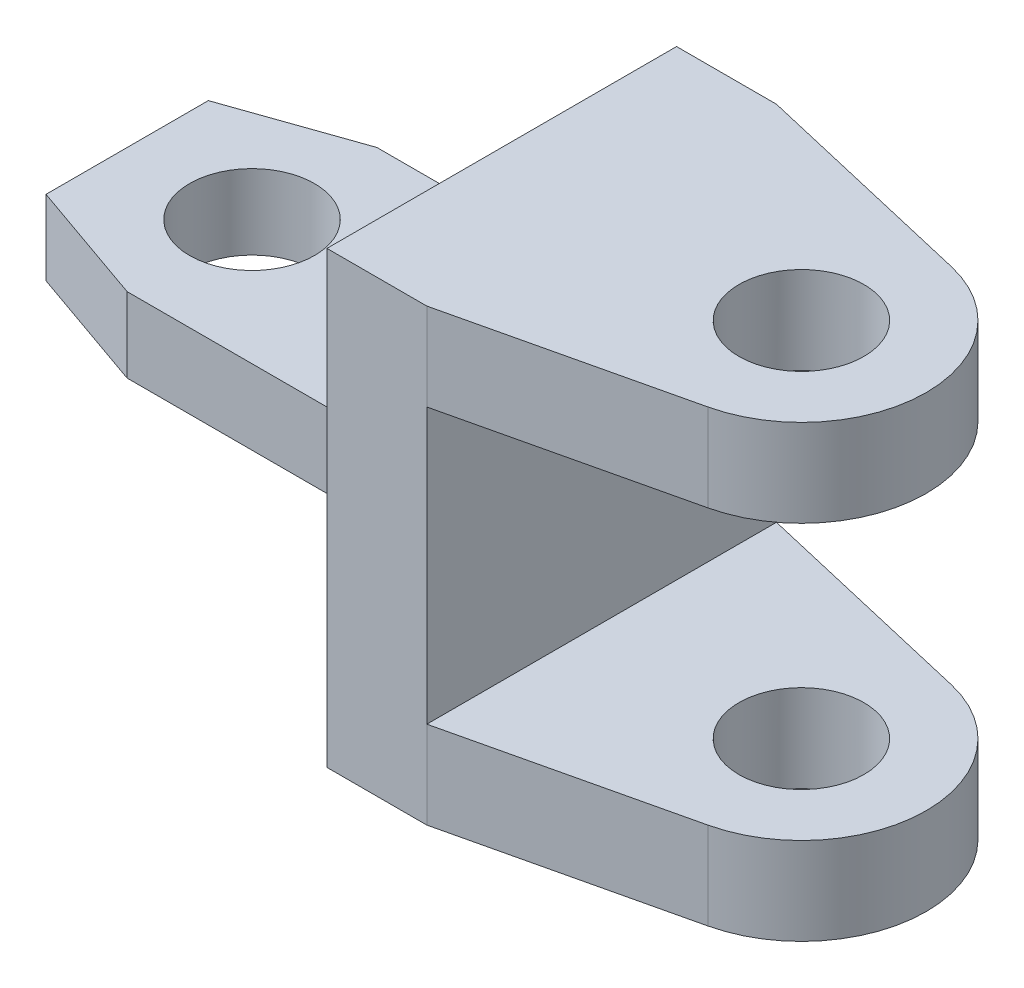
from build123d import *

# Parameters (mm, degrees)
BOSS_EXTRUDE3_DEPTH      = 18
BOSS_EXTRUDE3_DEPTH_BACK = 18
SKETCH1_R                = 5
BOSS_EXTRUDE4_DEPTH      = 3
BOSS_EXTRUDE4_DEPTH_BACK = 3
SKETCH1_5_R              = 5
SKETCH1_5_R_2            = 3
SKETCH3_W                = 40.653147646
SKETCH3_H                = 22
CUT_EXTRUDE2_DEPTH       = 48.581509013


with BuildPart() as part:
    # Sketch1 → Boss-Extrude3 (new, two sides: drawn at the far end of the back side and taken through both)
    with BuildSketch(Plane(origin=(0, 0, 0), x_dir=(1, 0, 0), z_dir=(0, 1, 0)).offset(-BOSS_EXTRUDE3_DEPTH_BACK)):
        with BuildLine():
            Line((0, 10), (0, -10))
            Line((0, -10), (0, -14))
            Line((0, -14), (8, -14))
            Line((8, -14), (26.271311561, -9.738641784))
            ThreePointArc((26.271311561, -9.738641784), (34, 0), (26.271311561, 9.738641784))
            Line((26.271311561, 9.738641784), (8, 14))
            Line((8, 14), (0, 14))
            Line((0, 14), (0, 10))
        make_face()
        with Locations((24, 0)):
            Circle(SKETCH1_R, mode=Mode.SUBTRACT)
    extrude(amount=BOSS_EXTRUDE3_DEPTH + BOSS_EXTRUDE3_DEPTH_BACK)

    # Sketch1<5> → Boss-Extrude4 (add, two sides: drawn at the far end of the back side and taken through both)
    with BuildSketch(Plane(origin=(0, 0, 0), x_dir=(1, 0, 0), z_dir=(0, 1, 0)).offset(-BOSS_EXTRUDE4_DEPTH_BACK)):
        Polygon((-30, 6.5), (-30, -6.5), (-20, -10), (0, -10), (0, 10), (-20, 10), align=None)
        with Locations((-20, 0)):
            Circle(SKETCH1_5_R, mode=Mode.SUBTRACT)
        with Locations((-7, 0)):
            Circle(SKETCH1_5_R_2, mode=Mode.SUBTRACT)
    extrude(amount=BOSS_EXTRUDE4_DEPTH + BOSS_EXTRUDE4_DEPTH_BACK)

    # Sketch3 → Cut-Extrude2 (cut, through all)
    with BuildSketch(Plane(origin=(0, 0, -14), x_dir=(-1, 0, 0), z_dir=(0, 0, -1))):
        with Locations((-28.326573823, 0)):
            Rectangle(SKETCH3_W, SKETCH3_H)
    extrude(amount=-CUT_EXTRUDE2_DEPTH, mode=Mode.SUBTRACT)


solid = part.part
